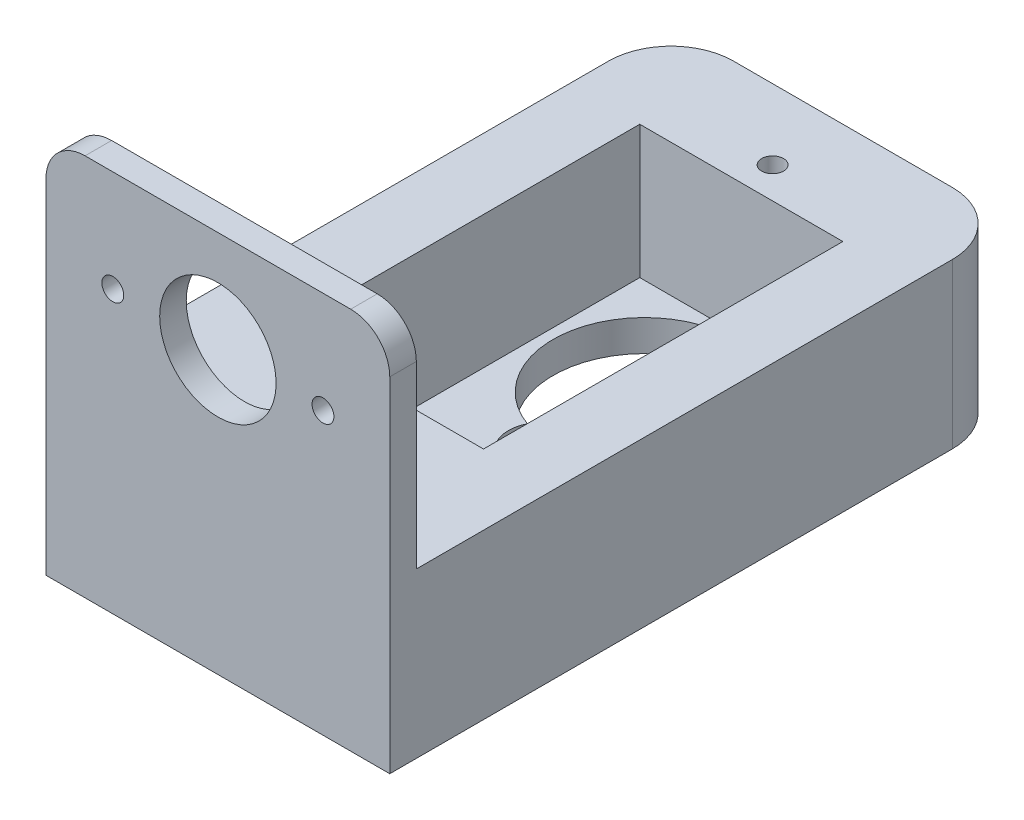
from build123d import *

# Parameters (mm, degrees)
SKETCH1_W           = 22
SKETCH1_H           = 40
BOSS_EXTRUDE1_DEPTH = 10.5
SKETCH2_W           = 13
SKETCH2_H           = 23
CUT_EXTRUDE1_DEPTH  = 8.5
SKETCH3_R           = 5.85
CUT_EXTRUDE2_DEPTH  = 47.435439053
SKETCH4_W           = 22
SKETCH4_H           = 1.7
BOSS_EXTRUDE2_DEPTH = 14
SKETCH5_R           = 3.725
CUT_EXTRUDE3_DEPTH  = 51.508811113
SKETCH5_3_R         = 3.725
SKETCH5_3_R_2       = 0.7
CUT_EXTRUDE4_DEPTH  = 10
SKETCH6_R           = 0.7
CUT_EXTRUDE5_DEPTH  = 2.5
FILLET1_R           = 4
FILLET2_R           = 2.5
CUT_EXTRUDE6_DEPTH  = 10


with BuildPart() as part:
    # Sketch1 → Boss-Extrude1 (new body)
    with BuildSketch(Plane(origin=(0, 0, 0), x_dir=(1, 0, 0), z_dir=(0, 1, 0))):
        with Locations((11, 20)):
            Rectangle(SKETCH1_W, SKETCH1_H)
    extrude(amount=BOSS_EXTRUDE1_DEPTH)

    # Sketch2 → Cut-Extrude1 (cut)
    with BuildSketch(Plane(origin=(0, 10.5, 0), x_dir=(1, 0, 0), z_dir=(0, 1, 0))):
        with Locations((11, 22)):
            Rectangle(SKETCH2_W, SKETCH2_H)
    extrude(amount=-CUT_EXTRUDE1_DEPTH, mode=Mode.SUBTRACT)

    # Sketch3 → Cut-Extrude2 (cut, through all)
    with BuildSketch(Plane(origin=(0, 2, 0), x_dir=(1, 0, 0), z_dir=(0, 1, 0))):
        with Locations((11, 27.3)):
            Circle(SKETCH3_R)
    extrude(amount=-CUT_EXTRUDE2_DEPTH, mode=Mode.SUBTRACT)

    # Sketch4 → Boss-Extrude2 (add)
    with BuildSketch(Plane(origin=(0, 10.5, 0), x_dir=(1, 0, 0), z_dir=(0, 1, 0))):
        with Locations((11, 0.85)):
            Rectangle(SKETCH4_W, SKETCH4_H)
    extrude(amount=BOSS_EXTRUDE2_DEPTH)

    # Sketch5 → Cut-Extrude3 (cut, through all)
    with BuildSketch(Plane(origin=(0, 0, -1.7), x_dir=(-1, 0, 0), z_dir=(0, 0, -1))):
        with Locations((-11, 18)):
            Circle(SKETCH5_R)
    extrude(amount=-CUT_EXTRUDE3_DEPTH, mode=Mode.SUBTRACT)

    # Sketch5<3> → Cut-Extrude4 (cut)
    with BuildSketch(Plane(origin=(0, 0, -1.7), x_dir=(-1, 0, 0), z_dir=(0, 0, -1))):
        with Locations((-11, 18)):
            Circle(SKETCH5_3_R)
        with Locations((-17.725, 18)):
            Circle(SKETCH5_3_R_2)
        with Locations((-4.275, 18)):
            Circle(SKETCH5_3_R_2)
    extrude(amount=-CUT_EXTRUDE4_DEPTH, mode=Mode.SUBTRACT)

    # Sketch6 → Cut-Extrude5 (cut)
    with BuildSketch(Plane(origin=(0, 10.5, 0), x_dir=(1, 0, 0), z_dir=(0, 1, 0))):
        with Locations((11, 35.5)):
            Circle(SKETCH6_R)
        with Locations((11, 7.5)):
            Circle(SKETCH6_R)
    extrude(amount=-CUT_EXTRUDE5_DEPTH, mode=Mode.SUBTRACT)

    # Fillet1
    fillet1_edges = [part.edges().sort_by_distance(p)[0] for p in [
        (0, 5.25, -40),
        (22, 5.25, -40),
    ]]
    fillet(fillet1_edges, radius=FILLET1_R)

    # Fillet2
    fillet2_edges = [part.edges().sort_by_distance(p)[0] for p in [
        (0, 24.5, -0.85),
        (22, 24.5, -0.85),
    ]]
    fillet(fillet2_edges, radius=FILLET2_R)

    # Sketch7 → Cut-Extrude6 (cut)
    with BuildSketch(Plane(origin=(0, 2, 0), x_dir=(1, 0, 0), z_dir=(0, 1, 0))):
        with BuildLine():
            ThreePointArc((9.023699499, 21.833388834), (10.872986109, 18.699861887), (12.803373856, 21.784088734))
            ThreePointArc((12.803373856, 21.784088734), (10.909436036, 21.494356303), (9.023699499, 21.833388834))
        make_face()
    extrude(amount=-CUT_EXTRUDE6_DEPTH, mode=Mode.SUBTRACT)


solid = part.part
